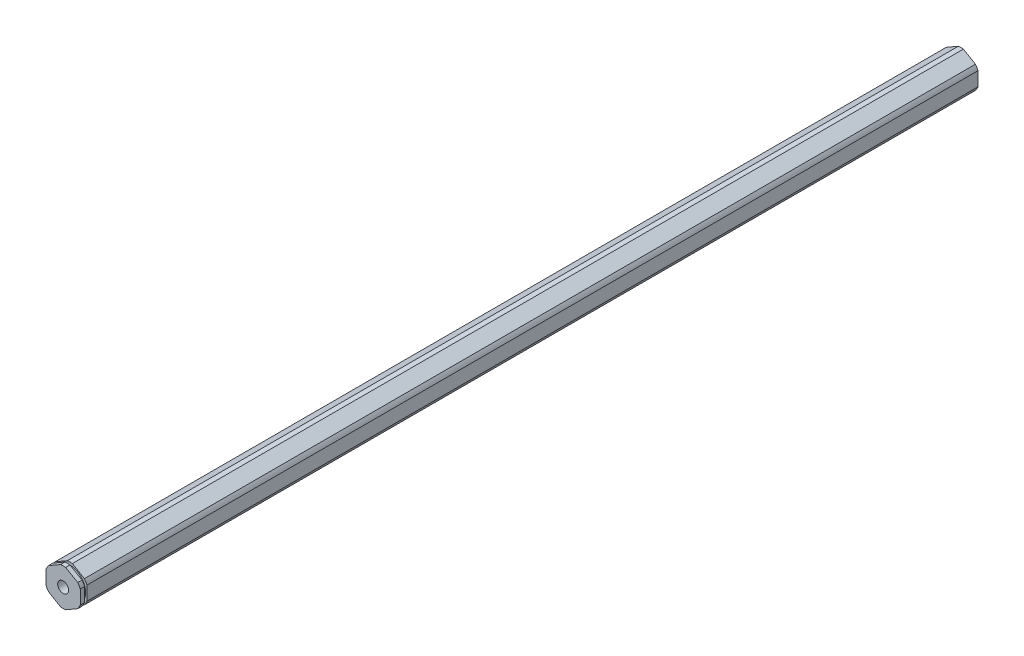
from build123d import *

# Parameters (mm, degrees)
BOSS_EXTRUDE1_DEPTH                  = 166.33825
F_10_32_TAPPED_HOLE1_D               = 4.0386
F_10_32_TAPPED_HOLE1_DEPTH           = 16.34744
F_10_32_TAPPED_HOLE1_TIP             = 1.213317848
F_10_32_TAPPED_HOLE1_ON_FACE_2_D     = 4.0386
F_10_32_TAPPED_HOLE1_ON_FACE_2_DEPTH = 16.34744
F_10_32_TAPPED_HOLE1_ON_FACE_2_TIP   = 1.213317848
SKETCH5_W                            = 0.889
SKETCH5_H                            = 1.0033


with BuildPart() as part:
    # Sketch1 → Boss-Extrude1 (new, symmetric)
    with BuildSketch(Plane.XY):
        with BuildLine():
            ThreePointArc((0.93173274, 6.79441227), (0, 6.858), (-0.93173274, 6.79441227))
            Line((-0.93173274, 6.79441227), (-5.41826726, 4.204110358))
            ThreePointArc((-5.41826726, 4.204110358), (-5.939202219, 3.429), (-6.35, 2.590301913))
            Line((-6.35, 2.590301913), (-6.35, -2.590301913))
            ThreePointArc((-6.35, -2.590301913), (-5.939202219, -3.429), (-5.41826726, -4.204110358))
            Line((-5.41826726, -4.204110358), (-0.93173274, -6.79441227))
            ThreePointArc((-0.93173274, -6.79441227), (0, -6.858), (0.93173274, -6.79441227))
            Line((0.93173274, -6.79441227), (5.41826726, -4.204110358))
            ThreePointArc((5.41826726, -4.204110358), (5.939202219, -3.429), (6.35, -2.590301913))
            Line((6.35, -2.590301913), (6.35, 2.590301913))
            ThreePointArc((6.35, 2.590301913), (5.939202219, 3.429), (5.41826726, 4.204110358))
            Line((5.41826726, 4.204110358), (0.93173274, 6.79441227))
        make_face()
    extrude(amount=BOSS_EXTRUDE1_DEPTH, both=True)

    # #10-32 Tapped Hole1
    with Locations(Plane.XY.offset(166.33825)):
        with Locations((0, 0)):
            Hole(F_10_32_TAPPED_HOLE1_D / 2, depth=F_10_32_TAPPED_HOLE1_DEPTH)
            with Locations((0, 0, -(F_10_32_TAPPED_HOLE1_DEPTH + F_10_32_TAPPED_HOLE1_TIP / 2))):  # 118° drill point
                Cone(0, F_10_32_TAPPED_HOLE1_D / 2, F_10_32_TAPPED_HOLE1_TIP, mode=Mode.SUBTRACT)

    # #10-32 Tapped Hole1 on face 2
    with Locations(Plane(origin=(0, 0, -166.33825), x_dir=(-1, 0, 0), z_dir=(0, 0, -1))):
        with Locations((0, 0)):
            Hole(F_10_32_TAPPED_HOLE1_ON_FACE_2_D / 2, depth=F_10_32_TAPPED_HOLE1_ON_FACE_2_DEPTH)
            with Locations((0, 0, -(F_10_32_TAPPED_HOLE1_ON_FACE_2_DEPTH + F_10_32_TAPPED_HOLE1_ON_FACE_2_TIP / 2))):  # 118° drill point
                Cone(0, F_10_32_TAPPED_HOLE1_ON_FACE_2_D / 2, F_10_32_TAPPED_HOLE1_ON_FACE_2_TIP, mode=Mode.SUBTRACT)

    # Sketch5 → Cut-Revolve1 (revolve, cut)
    with BuildSketch(Plane(origin=(0, 0, 0), x_dir=(0, 0, -1), z_dir=(1, 0, 0)), mode=Mode.PRIVATE) as cut_revolve1_sk:
        with Locations((-164.30625, 6.35635)):
            Rectangle(SKETCH5_W, SKETCH5_H)
    revolve(cut_revolve1_sk.sketch.rotate(Axis((0, 0, 165.047176272), (0, 0, -1)), 90), axis=Axis((0, 0, 165.047176272), (0, 0, -1)), mode=Mode.SUBTRACT)


solid = part.part
